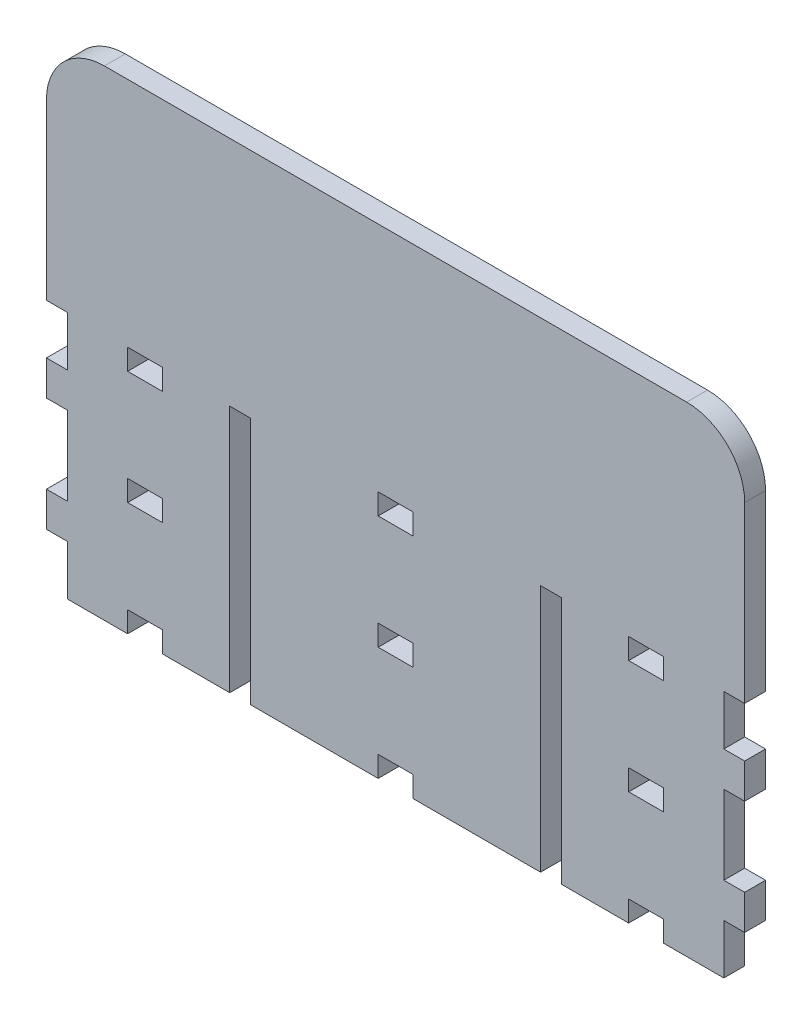
from build123d import *

# Parameters (mm, degrees)
BOSS_EXTRU_1_DEPTH      = 18
ESQUISSE2_W             = 30
ESQUISSE2_H             = 18
ENL_V_MAT_EXTRU_1_DEPTH = 1002.986027847
ESQUISSE3_W             = 18
ESQUISSE3_H             = 43
ESQUISSE3_H_2           = 68
ENL_V_MAT_EXTRU_2_DEPTH = 1002.986027847
ESQUISSE4_W             = 18
ESQUISSE4_H             = 214
ENL_V_MAT_EXTRU_3_DEPTH = 18
ENL_V_MAT_EXTRU_4_DEPTH = 10


with BuildPart() as part:
    # Esquisse1 → Boss.-Extru.1 (new body)
    with BuildSketch(Plane.XY):
        with BuildLine():
            Line((-584, 400), (18, 400))
            Line((18, 400), (18, 764))
            ThreePointArc((18, 764), (3.355339059, 799.355339059), (-32, 814))
            Line((-32, 814), (-534, 814))
            ThreePointArc((-534, 814), (-569.355339059, 799.355339059), (-584, 764))
            Line((-584, 764), (-584, 400))
        make_face()
    extrude(amount=-BOSS_EXTRU_1_DEPTH)

    # Esquisse2 → Enlèv. mat.-Extru.1 (cut, through all)
    with BuildSketch(Plane.XY):
        with Locations((-499, 605)):
            Rectangle(ESQUISSE2_W, ESQUISSE2_H)
        with Locations((-283, 605)):
            Rectangle(ESQUISSE2_W, ESQUISSE2_H)
        with Locations((-67, 605)):
            Rectangle(ESQUISSE2_W, ESQUISSE2_H)
        with Locations((-67, 507)):
            Rectangle(ESQUISSE2_W, ESQUISSE2_H)
        with Locations((-283, 507)):
            Rectangle(ESQUISSE2_W, ESQUISSE2_H)
        with Locations((-499, 507)):
            Rectangle(ESQUISSE2_W, ESQUISSE2_H)
        with Locations((-499, 409)):
            Rectangle(ESQUISSE2_W, ESQUISSE2_H)
        with Locations((-283, 409)):
            Rectangle(ESQUISSE2_W, ESQUISSE2_H)
        with Locations((-67, 409)):
            Rectangle(ESQUISSE2_W, ESQUISSE2_H)
    extrude(amount=-ENL_V_MAT_EXTRU_1_DEPTH, mode=Mode.SUBTRACT)

    # Esquisse3 → Enlèv. mat.-Extru.2 (cut, through all)
    with BuildSketch(Plane.XY):
        with Locations((9, 421.5)):
            Rectangle(ESQUISSE3_W, ESQUISSE3_H)
        with Locations((9, 507)):
            Rectangle(ESQUISSE3_W, ESQUISSE3_H_2)
        with Locations((9, 592.5)):
            Rectangle(ESQUISSE3_W, ESQUISSE3_H)
        with Locations((-575, 421.5)):
            Rectangle(ESQUISSE3_W, ESQUISSE3_H)
        with Locations((-575, 507)):
            Rectangle(ESQUISSE3_W, ESQUISSE3_H_2)
        with Locations((-575, 592.5)):
            Rectangle(ESQUISSE3_W, ESQUISSE3_H)
    extrude(amount=-ENL_V_MAT_EXTRU_2_DEPTH, mode=Mode.SUBTRACT)

    # Esquisse4 → Enlèv. mat.-Extru.3 (cut)
    with BuildSketch(Plane.XY):
        with Locations((-417, 507)):
            Rectangle(ESQUISSE4_W, ESQUISSE4_H)
        with Locations((-149, 507)):
            Rectangle(ESQUISSE4_W, ESQUISSE4_H)
    extrude(amount=-ENL_V_MAT_EXTRU_3_DEPTH, mode=Mode.SUBTRACT)

    # Esquisse6 → Enlèv. mat.-Extru.4 (cut)
    # profile 1 of 2: a face of its own
    with BuildSketch(Plane.XY.offset(-18)):
        with BuildLine():
            add(Edge.make_bspline(
                [(-167.994129765, 780.551148801), (-159.69231092, 785.059400753), (-149.968184403, 788.19753823), (-138.643294269, 789.083100025)],
                knots=[8, 8, 8, 8, 9, 9, 9, 9], degree=3))
            add(Edge.make_bspline(
                [(-188.812497273, 763.827966296), (-183.155305977, 770.374336737), (-176.556570084, 775.900958915), (-167.994129765, 780.551148801)],
                knots=[7, 7, 7, 7, 8, 8, 8, 8], degree=3))
            add(Edge.make_bspline(
                [(-207.242035572, 707.856705731), (-209.360769295, 732.945441347), (-200.095357242, 750.771915681), (-188.812497273, 763.827966296)],
                knots=[6, 6, 6, 6, 7, 7, 7, 7], degree=3))
            add(Edge.make_bspline(
                [(-182.328310806, 658.02856718), (-195.876148801, 669.799424924), (-205.394258608, 685.973459208), (-207.242035572, 707.856705731)],
                knots=[5, 5, 5, 5, 6, 6, 6, 6], degree=3))
            add(Edge.make_bspline(
                [(-126.35705024, 639.599028881), (-150.308215328, 637.632568378), (-169.381469717, 646.779985911), (-182.328310806, 658.02856718)],
                knots=[4, 4, 4, 4, 5, 5, 5, 5], degree=3))
            add(Edge.make_bspline(
                [(-76.52856718, 664.512925902), (-88.391753483, 650.987136517), (-103.937402351, 641.43939889), (-126.35705024, 639.599028881)],
                knots=[3, 3, 3, 3, 4, 4, 4, 4], degree=3))
            add(Edge.make_bspline(
                [(-57.757964428, 720.143294269), (-55.824232333, 695.416121424), (-64.848315447, 677.831665048), (-76.52856718, 664.512925902)],
                knots=[2, 2, 2, 2, 3, 3, 3, 3], degree=3))
            add(Edge.make_bspline(
                [(-82.331141506, 770.312497273), (-69.542602555, 759.036010731), (-59.51186254, 742.565353725), (-57.757964428, 720.143294269)],
                knots=[1, 1, 1, 1, 2, 2, 2, 2], degree=3))
            add(Edge.make_bspline(
                [(-138.643294269, 789.083100025), (-114.190006515, 790.995472528), (-95.136561424, 781.603797726), (-82.331141506, 770.312497273)],
                knots=[0, 0, 0, 0, 1, 1, 1, 1], degree=3))
        make_face()
        with BuildLine():
            add(Edge.make_bspline(
                [(-96.323741328, 691.133523226), (-89.767035601, 695.117431645), (-83.328152139, 708.875075956), (-84.719970715, 720.143294269)],
                knots=[21, 21, 21, 21, 22, 22, 22, 22], degree=3))
            add(Edge.make_bspline(
                [(-111.33987902, 657.687502727), (-102.948659947, 666.226516396), (-98.617830412, 677.655620669), (-96.323741328, 691.133523226)],
                knots=[20, 20, 20, 20, 21, 21, 21, 21], degree=3))
            add(Edge.make_bspline(
                [(-120.555164934, 650.861735042), (-117.389466692, 651.549376101), (-113.938514545, 655.043736451), (-111.33987902, 657.687502727)],
                knots=[19, 19, 19, 19, 20, 20, 20, 20], degree=3))
            add(Edge.make_bspline(
                [(-140.691059026, 650.861735042), (-137.867458766, 650.386311865), (-134.320388454, 650.861735042), (-130.793816461, 650.861735042), (-127.586949328, 650.861735042), (-123.623711482, 650.195109065), (-120.555164934, 650.861735042)],
                knots=[17, 17, 17, 17, 18, 18, 18, 19, 19, 19, 19], degree=3))
            add(Edge.make_bspline(
                [(-153.318712017, 658.369976142), (-150.305114742, 655.38790149), (-145.157625322, 651.613454877), (-140.691059026, 650.861735042)],
                knots=[16, 16, 16, 16, 17, 17, 17, 17], degree=3))
            add(Edge.make_bspline(
                [(-168.335538728, 691.474932189), (-166.067804625, 679.494612639), (-161.208497443, 666.175873493), (-153.318712017, 658.369976142)],
                knots=[15, 15, 15, 15, 16, 16, 16, 16], degree=3))
            add(Edge.make_bspline(
                [(-180.280546049, 714.341064453), (-179.533132584, 704.638297528), (-174.894656022, 693.974348963), (-168.335538728, 691.474932189)],
                knots=[14, 14, 14, 14, 15, 15, 15, 15], degree=3))
            add(Edge.make_bspline(
                [(-176.526425499, 725.944835066), (-181.121321602, 725.538486054), (-180.605935318, 718.564407008), (-180.280546049, 714.341064453)],
                knots=[13, 13, 13, 13, 14, 14, 14, 14], degree=3))
            add(Edge.make_bspline(
                [(-177.208898915, 719.119411891), (-177.024930816, 721.820022242), (-174.639374447, 724.112733287), (-176.526425499, 725.944835066)],
                knots=[12, 12, 12, 12, 13, 13, 13, 13], degree=3))
            add(Edge.make_bspline(
                [(-169.359421106, 695.570117192), (-173.859921593, 698.133268233), (-177.653316232, 712.591644966), (-177.208898915, 719.119411891)],
                knots=[11, 11, 11, 11, 12, 12, 12, 12], degree=3))
            add(Edge.make_bspline(
                [(-165.263719339, 694.887643776), (-166.635039597, 694.77016602), (-168.255268003, 694.941387266), (-169.359421106, 695.570117192)],
                knots=[10, 10, 10, 10, 11, 11, 11, 11], degree=3))
            add(Edge.make_bspline(
                [(-150.588301591, 660.417740899), (-159.102338318, 668.466861991), (-163.545822475, 681.890676549), (-165.263719339, 694.887643776)],
                knots=[9, 9, 9, 9, 10, 10, 10, 10], degree=3))
            add(Edge.make_bspline(
                [(-140.349650063, 654.27444663), (-143.90050998, 654.870448148), (-147.821200897, 657.801535387), (-150.588301591, 660.417740899)],
                knots=[8, 8, 8, 8, 9, 9, 9, 9], degree=3))
            add(Edge.make_bspline(
                [(-121.237982859, 654.27444663), (-124.079153105, 653.635725927), (-127.959019641, 654.27444663), (-130.793816461, 654.27444663), (-134.253553602, 654.27444663), (-137.601497395, 653.813148344), (-140.349650063, 654.27444663)],
                knots=[6, 6, 6, 6, 7, 7, 7, 8, 8, 8, 8], degree=3))
            add(Edge.make_bspline(
                [(-112.363761398, 661.100214314), (-114.830449766, 658.456448039), (-118.402669274, 654.911789294), (-121.237982859, 654.27444663)],
                knots=[5, 5, 5, 5, 6, 6, 6, 6], degree=3))
            add(Edge.make_bspline(
                [(-99.395732973, 694.546234814), (-101.128616002, 681.120008689), (-104.816590719, 669.191710081), (-112.363761398, 661.100214314)],
                knots=[4, 4, 4, 4, 5, 5, 5, 5], degree=3))
            add(Edge.make_bspline(
                [(-96.323741328, 694.887643776), (-97.432717565, 694.104573573), (-98.43592937, 695.337228737), (-99.395732973, 694.546234814)],
                knots=[3, 3, 3, 3, 4, 4, 4, 4], degree=3))
            add(Edge.make_bspline(
                [(-88.132682303, 720.484358722), (-86.157953571, 711.086138239), (-92.116246212, 700.144514977), (-96.323741328, 694.887643776)],
                knots=[2, 2, 2, 2, 3, 3, 3, 3], degree=3))
            add(Edge.make_bspline(
                [(-90.521511512, 726.286244029), (-90.293101682, 724.298079425), (-88.626019976, 722.830985512), (-88.132682303, 720.484358722)],
                knots=[1, 1, 1, 1, 2, 2, 2, 2], degree=3))
            add(Edge.make_bspline(
                [(-84.719970715, 720.143294269), (-85.131659626, 723.475390623), (-88.352134885, 730.701650658), (-90.521511512, 726.286244029)],
                knots=[0, 0, 0, 0, 1, 1, 1, 1], degree=3))
        make_face(mode=Mode.SUBTRACT)
        with BuildLine():
            add(Edge.make_bspline(
                [(-165.263719339, 731.746892628), (-167.581407326, 731.2948961), (-169.289313413, 730.878556311), (-170.041894522, 729.016482201)],
                knots=[14, 14, 14, 14, 15, 15, 15, 15], degree=3))
            add(Edge.make_bspline(
                [(-164.922310376, 732.088301591), (-165.194300665, 732.068147782), (-165.222722702, 731.754644093), (-165.263719339, 731.746892628)],
                knots=[13, 13, 13, 13, 14, 14, 14, 14], degree=3))
            add(Edge.make_bspline(
                [(-95.640923403, 729.357546654), (-97.547783754, 732.657775874), (-105.330254456, 732.088301591), (-110.657750114, 732.088301591), (-116.752124027, 732.088301591), (-123.382899308, 732.088301591), (-128.74587945, 732.088301591), (-142.766556801, 732.088301591), (-152.996595589, 732.963700353), (-164.922310376, 732.088301591)],
                knots=[10, 10, 10, 10, 11, 11, 11, 12, 12, 12, 13, 13, 13, 13], degree=3))
            add(Edge.make_bspline(
                [(-97.347623707, 713.317182075), (-96.401600486, 716.391585286), (-93.615551768, 725.852678762), (-95.640923403, 729.357546654)],
                knots=[9, 9, 9, 9, 10, 10, 10, 10], degree=3))
            add(Edge.make_bspline(
                [(-105.19727377, 702.396229387), (-100.721061206, 703.809407555), (-98.74185385, 708.786537002), (-97.347623707, 713.317182075)],
                knots=[8, 8, 8, 8, 9, 9, 9, 9], degree=3))
            add(Edge.make_bspline(
                [(-121.237982859, 702.396229387), (-117.704348419, 701.239021813), (-108.404657667, 701.383371314), (-105.19727377, 702.396229387)],
                knots=[7, 7, 7, 7, 8, 8, 8, 8], degree=3))
            add(Edge.make_bspline(
                [(-126.698114693, 707.515296768), (-125.474761286, 705.702832033), (-123.047691517, 702.98878581), (-121.237982859, 702.396229387)],
                knots=[6, 6, 6, 6, 7, 7, 7, 7], degree=3))
            add(Edge.make_bspline(
                [(-131.817698839, 712.975773112), (-128.721074762, 712.897569445), (-128.143676759, 709.656423612), (-126.698114693, 707.515296768)],
                knots=[5, 5, 5, 5, 6, 6, 6, 6], degree=3))
            add(Edge.make_bspline(
                [(-136.936938475, 707.515296768), (-135.760438367, 709.240945097), (-135.422646755, 713.067757162), (-131.817698839, 712.975773112)],
                knots=[4, 4, 4, 4, 5, 5, 5, 5], degree=3))
            add(Edge.make_bspline(
                [(-142.39741482, 702.396229387), (-140.443012151, 703.089038089), (-138.123946125, 705.774834529), (-136.936938475, 707.515296768)],
                knots=[3, 3, 3, 3, 4, 4, 4, 4], degree=3))
            add(Edge.make_bspline(
                [(-159.803242994, 702.73729384), (-156.470629877, 701.472943797), (-145.597908525, 701.261759443), (-142.39741482, 702.396229387)],
                knots=[2, 2, 2, 2, 3, 3, 3, 3], degree=3))
            add(Edge.make_bspline(
                [(-167.652548548, 713.658935547), (-166.203713642, 709.484168838), (-164.250344502, 704.424701608), (-159.803242994, 702.73729384)],
                knots=[1, 1, 1, 1, 2, 2, 2, 2], degree=3))
            add(Edge.make_bspline(
                [(-170.041894522, 729.016482201), (-171.618025706, 725.117495386), (-168.325720206, 715.597490777), (-167.652548548, 713.658935547)],
                knots=[0, 0, 0, 0, 1, 1, 1, 1], degree=3))
        make_face(mode=Mode.SUBTRACT)
        with BuildLine():
            add(Edge.make_bspline(
                [(-99.395732973, 739.937779399), (-99.5121772, 743.107267245), (-103.825436748, 743.925821933), (-106.562220601, 744.715782327)],
                knots=[14, 14, 14, 14, 15, 15, 15, 15], degree=3))
            add(Edge.make_bspline(
                [(-106.903285054, 741.30272623), (-104.488273119, 740.578739414), (-101.782839634, 738.405573182), (-99.395732973, 739.937779399)],
                knots=[13, 13, 13, 13, 14, 14, 14, 14], degree=3))
            add(Edge.make_bspline(
                [(-124.308940974, 743.009426534), (-117.181727434, 743.290890835), (-111.771204975, 742.761724168), (-106.903285054, 741.30272623)],
                knots=[12, 12, 12, 12, 13, 13, 13, 13], degree=3))
            add(Edge.make_bspline(
                [(-123.626812068, 739.937779399), (-122.200542537, 741.25725097), (-124.643115236, 742.838549797), (-124.308940974, 743.009426534)],
                knots=[11, 11, 11, 11, 12, 12, 12, 12], degree=3))
            add(Edge.make_bspline(
                [(-128.74587945, 741.30272623), (-127.13529731, 740.933239739), (-125.475450306, 738.584029128), (-123.626812068, 739.937779399)],
                knots=[10, 10, 10, 10, 11, 11, 11, 11], degree=3))
            add(Edge.make_bspline(
                [(-142.39741482, 740.620252815), (-137.8722819, 740.311916769), (-133.076364475, 742.295947259), (-128.74587945, 741.30272623)],
                knots=[9, 9, 9, 9, 10, 10, 10, 10], degree=3))
            add(Edge.make_bspline(
                [(-159.803242994, 748.470075132), (-154.395648866, 745.531236429), (-150.242069494, 741.154931634), (-142.39741482, 740.620252815)],
                knots=[8, 8, 8, 8, 9, 9, 9, 9], degree=3))
            add(Edge.make_bspline(
                [(-162.874890129, 738.231423605), (-161.378168396, 741.027979865), (-159.935190152, 744.61845838), (-159.803242994, 748.470075132)],
                knots=[7, 7, 7, 7, 8, 8, 8, 8], degree=3))
            add(Edge.make_bspline(
                [(-166.629182934, 735.501013178), (-164.136139586, 734.100237354), (-163.743570956, 736.607750103), (-162.874890129, 738.231423605)],
                knots=[6, 6, 6, 6, 7, 7, 7, 7], degree=3))
            add(Edge.make_bspline(
                [(-163.215954582, 749.835021964), (-162.18759358, 744.43121744), (-166.808155645, 739.636161289), (-166.629182934, 735.501013178)],
                knots=[5, 5, 5, 5, 6, 6, 6, 6], degree=3))
            add(Edge.make_bspline(
                [(-165.605128301, 754.613197147), (-165.278016485, 752.26415879), (-163.600944003, 751.857465268), (-163.215954582, 749.835021964)],
                knots=[4, 4, 4, 4, 5, 5, 5, 5], degree=3))
            add(Edge.make_bspline(
                [(-159.461661777, 752.565260136), (-161.86289333, 754.463507748), (-164.079812275, 757.267643218), (-165.605128301, 754.613197147)],
                knots=[3, 3, 3, 3, 4, 4, 4, 4], degree=3))
            add(Edge.make_bspline(
                [(-133.524054633, 744.715782327), (-145.625986054, 742.483360453), (-152.676201709, 747.200901956), (-159.461661777, 752.565260136)],
                knots=[2, 2, 2, 2, 3, 3, 3, 3], degree=3))
            add(Edge.make_bspline(
                [(-130.793816461, 745.73983696), (-131.731915962, 745.530375155), (-132.501378038, 744.90422905), (-133.524054633, 744.715782327)],
                knots=[1, 1, 1, 1, 2, 2, 2, 2], degree=3))
            add(Edge.make_bspline(
                [(-106.562220601, 744.715782327), (-113.384198681, 746.684137633), (-122.915055341, 747.498041441), (-130.793816461, 745.73983696)],
                knots=[0, 0, 0, 0, 1, 1, 1, 1], degree=3))
        make_face(mode=Mode.SUBTRACT)
        with BuildLine():
            add(Edge.make_bspline(
                [(-174.137079525, 731.405483665), (-172.050901954, 731.697283253), (-172.84344617, 734.208068843), (-172.772132694, 735.159604216)],
                knots=[16, 16, 16, 16, 17, 17, 17, 17], degree=3))
            add(Edge.make_bspline(
                [(-176.185016536, 739.596370436), (-176.082008181, 736.845117182), (-176.745016808, 732.037141923), (-174.137079525, 731.405483665)],
                knots=[15, 15, 15, 15, 16, 16, 16, 16], degree=3))
            add(Edge.make_bspline(
                [(-175.843952083, 751.541377758), (-176.589815256, 748.484544533), (-176.351759158, 744.050534389), (-176.185016536, 739.596370436)],
                knots=[14, 14, 14, 14, 15, 15, 15, 15], degree=3))
            add(Edge.make_bspline(
                [(-137.619411891, 777.820738374), (-154.780293777, 776.558455388), (-172.045217547, 767.101151517), (-175.843952083, 751.541377758)],
                knots=[13, 13, 13, 13, 14, 14, 14, 14], degree=3))
            add(Edge.make_bspline(
                [(-114.411526155, 773.725208861), (-122.282880319, 776.29766166), (-128.826494684, 778.467555051), (-137.619411891, 777.820738374)],
                knots=[12, 12, 12, 12, 13, 13, 13, 13], degree=3))
            add(Edge.make_bspline(
                [(-99.736797426, 767.582086846), (-103.061314569, 770.178483059), (-108.789130323, 771.887422674), (-114.411526155, 773.725208861)],
                knots=[11, 11, 11, 11, 12, 12, 12, 12], degree=3))
            add(Edge.make_bspline(
                [(-90.863264984, 753.589142514), (-91.66046008, 758.665490711), (-96.793307843, 765.283519139), (-99.736797426, 767.582086846)],
                knots=[10, 10, 10, 10, 11, 11, 11, 11], degree=3))
            add(Edge.make_bspline(
                [(-91.887147363, 737.548950189), (-91.044477007, 741.320640727), (-90.46191136, 751.031331371), (-90.863264984, 753.589142514)],
                knots=[9, 9, 9, 9, 10, 10, 10, 10], degree=3))
            add(Edge.make_bspline(
                [(-94.617041025, 742.326608608), (-94.843383798, 740.066453715), (-96.311338985, 734.514854596), (-93.9342231, 734.135721837), (-92.148974619, 733.850984696), (-92.464200856, 734.964439556), (-91.887147363, 737.548950189)],
                knots=[7, 7, 7, 7, 8, 8, 8, 9, 9, 9, 9], degree=3))
            add(Edge.make_bspline(
                [(-93.9342231, 751.541377758), (-93.706502288, 748.963757315), (-94.273220496, 745.765158412), (-94.617041025, 742.326608608)],
                knots=[6, 6, 6, 6, 7, 7, 7, 7], degree=3))
            add(Edge.make_bspline(
                [(-102.466691088, 765.53432209), (-99.032964418, 763.120860448), (-94.382085513, 756.598605675), (-93.9342231, 751.541377758)],
                knots=[5, 5, 5, 5, 6, 6, 6, 6], degree=3))
            add(Edge.make_bspline(
                [(-115.777506515, 770.653389472), (-110.879614263, 769.070195841), (-105.576234273, 767.719890666), (-102.466691088, 765.53432209)],
                knots=[4, 4, 4, 4, 5, 5, 5, 5], degree=3))
            add(Edge.make_bspline(
                [(-137.960820854, 774.407682277), (-128.536417644, 775.083093246), (-122.86200087, 772.944205714), (-115.777506515, 770.653389472)],
                knots=[3, 3, 3, 3, 4, 4, 4, 4], degree=3))
            add(Edge.make_bspline(
                [(-164.23983696, 764.510439712), (-157.788551155, 769.886338962), (-147.056906463, 773.75621472), (-137.960820854, 774.407682277)],
                knots=[2, 2, 2, 2, 3, 3, 3, 3], degree=3))
            add(Edge.make_bspline(
                [(-172.772132694, 750.858904342), (-172.060892731, 755.388171376), (-168.271632207, 761.15061034), (-164.23983696, 764.510439712)],
                knots=[1, 1, 1, 1, 2, 2, 2, 2], degree=3))
            add(Edge.make_bspline(
                [(-172.772132694, 735.159604216), (-172.368022994, 740.550145121), (-173.551585547, 745.893488219), (-172.772132694, 750.858904342)],
                knots=[0, 0, 0, 0, 1, 1, 1, 1], degree=3))
        make_face(mode=Mode.SUBTRACT)
    # profile 2 of 2: a face of its own
    with BuildSketch(Plane.XY.offset(-18)):
        with BuildLine():
            add(Edge.make_bspline(
                [(-426.961036514, 639.581803404), (-404.9193156, 641.391512062), (-388.80315892, 651.176961279), (-377.141855212, 664.49156631)],
                knots=[7, 7, 7, 7, 8, 8, 8, 8], degree=3))
            add(Edge.make_bspline(
                [(-377.141855212, 664.49156631), (-365.58252633, 677.688693585), (-356.81510283, 696.606057405), (-358.770539027, 720.538791231)],
                knots=[8, 8, 8, 8, 9, 9, 9, 9], degree=3))
            add(Edge.make_bspline(
                [(-358.770539027, 720.538791231), (-360.61504315, 743.112262634), (-370.627868668, 758.941959624), (-383.680301933, 770.358489298)],
                knots=[0, 0, 0, 0, 1, 1, 1, 1], degree=3))
            add(Edge.make_bspline(
                [(-383.680301933, 770.358489298), (-396.699317772, 781.74573566), (-415.020335562, 790.997022821), (-440.038618976, 789.040553095)],
                knots=[1, 1, 1, 1, 2, 2, 2, 2], degree=3))
            add(Edge.make_bspline(
                [(-440.038618976, 789.040553095), (-451.182124833, 788.169288447), (-461.166183804, 784.854934336), (-469.307977964, 780.32239446)],
                knots=[2, 2, 2, 2, 3, 3, 3, 3], degree=3))
            add(Edge.make_bspline(
                [(-469.307977964, 780.32239446), (-477.690928808, 775.655323607), (-484.533060697, 770.254964179), (-490.16992593, 763.819698067)],
                knots=[3, 3, 3, 3, 4, 4, 4, 4], degree=3))
            add(Edge.make_bspline(
                [(-490.16992593, 763.819698067), (-501.449857568, 750.94038085), (-510.356462926, 732.074004444), (-508.229460973, 707.461208769)],
                knots=[4, 4, 4, 4, 5, 5, 5, 5], degree=3))
            add(Edge.make_bspline(
                [(-508.229460973, 707.461208769), (-506.324667679, 685.418798835), (-496.465665674, 669.771519651), (-483.008261435, 657.953119589)],
                knots=[5, 5, 5, 5, 6, 6, 6, 6], degree=3))
            add(Edge.make_bspline(
                [(-483.008261435, 657.953119589), (-470.055908194, 646.577758806), (-451.272386335, 637.586059589), (-426.961036514, 639.581803404)],
                knots=[6, 6, 6, 6, 7, 7, 7, 7], degree=3))
        make_face()
        with BuildLine():
            add(Edge.make_bspline(
                [(-400.494434958, 692.332675832), (-400.457572437, 691.435917477), (-400.664622675, 690.294212833), (-400.183342836, 689.841871796)],
                knots=[17, 17, 17, 17, 18, 18, 18, 18], degree=3))
            add(Edge.make_bspline(
                [(-400.183342836, 689.841871796), (-400.117197003, 688.529979435), (-401.57688396, 688.744264375), (-402.051618118, 687.973596515)],
                knots=[18, 18, 18, 18, 19, 19, 19, 19], degree=3))
            add(Edge.make_bspline(
                [(-402.051618118, 687.973596515), (-404.009121372, 676.167254287), (-407.839034023, 666.231943417), (-415.12920058, 658.704409781)],
                knots=[0, 0, 0, 0, 1, 1, 1, 1], degree=3))
            add(Edge.make_bspline(
                [(-415.12920058, 658.704409781), (-417.398829485, 656.360711323), (-420.427412926, 653.382081766), (-423.224485951, 652.788147305)],
                knots=[1, 1, 1, 1, 2, 2, 2, 2], degree=3))
            add(Edge.make_bspline(
                [(-423.224485951, 652.788147305), (-425.801072864, 652.241410651), (-429.078736709, 652.788147305), (-431.631896973, 652.788147305), (-434.655312771, 652.788147305), (-437.714213052, 652.470164991), (-440.038618976, 652.788147305)],
                knots=[2, 2, 2, 2, 3, 3, 3, 4, 4, 4, 4], degree=3))
            add(Edge.make_bspline(
                [(-440.038618976, 652.788147305), (-447.38425157, 653.793081658), (-453.163571501, 660.242300406), (-456.852924256, 666.177510908)],
                knots=[4, 4, 4, 4, 5, 5, 5, 5], degree=3))
            add(Edge.make_bspline(
                [(-456.852924256, 666.177510908), (-460.984799527, 672.823444609), (-463.204991312, 680.577321017), (-464.63728976, 688.284688637)],
                knots=[5, 5, 5, 5, 6, 6, 6, 6], degree=3))
            add(Edge.make_bspline(
                [(-464.63728976, 688.284688637), (-465.586758076, 688.892058971), (-466.775832782, 689.259995169), (-467.75096706, 689.841871796)],
                knots=[6, 6, 6, 6, 7, 7, 7, 7], degree=3))
            add(Edge.make_bspline(
                [(-467.75096706, 689.841871796), (-467.554079853, 690.889869843), (-466.856964781, 691.438673554), (-467.128266051, 692.955549096)],
                knots=[7, 7, 7, 7, 8, 8, 8, 8], degree=3))
            add(Edge.make_bspline(
                [(-467.128266051, 692.955549096), (-465.998274731, 691.802131127), (-464.416631394, 691.100365177), (-462.457750101, 690.775492673)],
                knots=[8, 8, 8, 8, 9, 9, 9, 9], degree=3))
            add(Edge.make_bspline(
                [(-462.457750101, 690.775492673), (-460.473030592, 679.900015245), (-456.820540359, 667.833568308), (-449.379995384, 660.883777185)],
                knots=[9, 9, 9, 9, 10, 10, 10, 10], degree=3))
            add(Edge.make_bspline(
                [(-449.379995384, 660.883777185), (-446.969634328, 658.632062776), (-443.471312118, 656.114386996), (-440.350055608, 655.590732482)],
                knots=[10, 10, 10, 10, 11, 11, 11, 11], degree=3))
            add(Edge.make_bspline(
                [(-440.350055608, 655.590732482), (-438.075603569, 655.208671393), (-434.866841634, 655.590732482), (-431.943333605, 655.590732482), (-429.420834691, 655.590732482), (-426.303023277, 655.071901102), (-423.847359215, 655.590732482)],
                knots=[11, 11, 11, 11, 12, 12, 12, 13, 13, 13, 13], degree=3))
            add(Edge.make_bspline(
                [(-423.847359215, 655.590732482), (-421.240455461, 656.14160325), (-418.124711104, 659.134013188), (-416.063165966, 661.506994959)],
                knots=[13, 13, 13, 13, 14, 14, 14, 14], degree=3))
            add(Edge.make_bspline(
                [(-416.063165966, 661.506994959), (-409.674580898, 668.859517743), (-406.024502231, 678.94193419), (-404.230985522, 690.46440055)],
                knots=[14, 14, 14, 14, 15, 15, 15, 15], degree=3))
            add(Edge.make_bspline(
                [(-404.230985522, 690.46440055), (-404.333304858, 691.91444124), (-402.604555943, 690.011370494), (-402.051618118, 691.087273814)],
                knots=[15, 15, 15, 15, 16, 16, 16, 16], degree=3))
            add(Edge.make_bspline(
                [(-402.051618118, 691.087273814), (-401.72950169, 691.516188202), (-400.816551386, 692.933155975), (-400.494434958, 692.332675832)],
                knots=[16, 16, 16, 16, 17, 17, 17, 17], degree=3))
        make_face(mode=Mode.SUBTRACT)
        with BuildLine():
            add(Edge.make_bspline(
                [(-490.792626939, 715.99703672), (-490.697197794, 716.010300338), (-490.615032267, 716.010300338), (-490.542340752, 716.000826325)],
                knots=[0, 0, 0, 0, 1, 1, 1, 1], degree=3))
            Line((-490.542340752, 716.000826325), (-490.542340752, 701.59791563))
            add(Edge.make_bspline(
                [(-490.542340752, 701.59791563), (-494.009829358, 704.094404073), (-493.498232678, 713.1892839), (-490.792626939, 715.99703672)],
                knots=[2, 2, 2, 2, 3, 3, 3, 3], degree=3))
        make_face(mode=Mode.SUBTRACT)
        with BuildLine():
            add(Edge.make_bspline(
                [(-479.253451866, 693.088529782), (-483.598406292, 694.082956593), (-486.696580662, 696.323818952), (-488.778451863, 699.581156733)],
                knots=[5, 5, 5, 5, 6, 6, 6, 6], degree=3))
            Line((-488.778451863, 699.581156733), (-488.778451863, 717.811568512))
            add(Edge.make_bspline(
                [(-488.778451863, 717.811568512), (-486.892606595, 721.187762088), (-483.570845528, 723.128901139), (-479.583147504, 724.403758723)],
                knots=[1, 1, 1, 1, 2, 2, 2, 2], degree=3))
            add(Edge.make_bspline(
                [(-479.583147504, 724.403758723), (-479.479277875, 724.403758723), (-479.375752755, 724.403758723), (-479.271883127, 724.403758723)],
                knots=[2, 2, 2, 2, 3, 3, 3, 3], degree=3))
            add(Edge.make_bspline(
                [(-479.271883127, 724.403758723), (-479.26516519, 724.400141373), (-479.259997547, 724.395490494), (-479.253451866, 724.391700889)],
                knots=[3, 3, 3, 3, 4, 4, 4, 4], degree=3))
            Line((-479.253451866, 724.391700889), (-479.253451866, 693.088529782))
        make_face(mode=Mode.SUBTRACT)
        with BuildLine():
            add(Edge.make_bspline(
                [(-469.307977964, 691.398365936), (-471.272199155, 690.847839678), (-475.481933583, 691.064880694), (-477.048590755, 691.086584795)],
                knots=[0, 0, 0, 0, 1, 1, 1, 1], degree=3))
            Line((-477.048590755, 691.086584795), (-477.048590755, 726.175743586))
            add(Edge.make_bspline(
                [(-477.048590755, 726.175743586), (-475.350158681, 727.013590808), (-471.388126618, 726.634113541), (-469.619242341, 726.272034005)],
                knots=[2, 2, 2, 2, 3, 3, 3, 3], degree=3))
            add(Edge.make_bspline(
                [(-469.619242341, 726.272034005), (-468.894738761, 715.268399025), (-469.513994674, 702.920832296), (-469.307977964, 691.398365936)],
                knots=[3, 3, 3, 3, 4, 4, 4, 4], degree=3))
        make_face(mode=Mode.SUBTRACT)
        with BuildLine():
            add(Edge.make_bspline(
                [(-398.626159677, 725.026631987), (-397.15096979, 726.117521472), (-392.785000281, 725.74579567), (-390.706229666, 725.369246733)],
                knots=[1, 1, 1, 1, 2, 2, 2, 2], degree=3))
            Line((-390.706229666, 725.369246733), (-390.706229666, 690.425126462))
            add(Edge.make_bspline(
                [(-390.706229666, 690.425126462), (-392.781555186, 689.955215438), (-396.65487604, 689.967273272), (-398.626159677, 690.46440055)],
                knots=[3, 3, 3, 3, 4, 4, 4, 4], degree=3))
            add(Edge.make_bspline(
                [(-398.626159677, 690.46440055), (-398.626159677, 701.985488872), (-398.626159677, 713.505543665), (-398.626159677, 725.026631987)],
                knots=[0, 0, 0, 0, 1, 1, 1, 1], degree=3))
        make_face(mode=Mode.SUBTRACT)
        with BuildLine():
            add(Edge.make_bspline(
                [(-379.064563002, 698.722294429), (-380.42434219, 694.911674312), (-385.002185071, 693.18878206), (-388.501368555, 692.431205563)],
                knots=[3, 3, 3, 3, 4, 4, 4, 4], degree=3))
            Line((-388.501368555, 692.431205563), (-388.501368555, 723.3530046))
            add(Edge.make_bspline(
                [(-388.501368555, 723.3530046), (-385.248509398, 722.537205989), (-380.536996812, 721.069939822), (-379.064563002, 716.774767026)],
                knots=[1, 1, 1, 1, 2, 2, 2, 2], degree=3))
            Line((-379.064563002, 716.774767026), (-379.064563002, 698.722294429))
        make_face(mode=Mode.SUBTRACT)
        with BuildLine():
            add(Edge.make_bspline(
                [(-376.83007407, 715.062726825), (-374.698938003, 712.144730949), (-373.687113459, 703.184554356), (-377.300674113, 700.979520991)],
                knots=[2, 2, 2, 2, 3, 3, 3, 3], degree=3))
            Line((-377.300674113, 700.979520991), (-377.300674113, 715.062726825))
            add(Edge.make_bspline(
                [(-377.300674113, 715.062726825), (-377.143922269, 715.062726825), (-376.987170424, 715.062726825), (-376.83007407, 715.062726825)],
                knots=[1, 1, 1, 1, 2, 2, 2, 2], degree=3))
        make_face(mode=Mode.SUBTRACT)
        with BuildLine():
            add(Edge.make_bspline(
                [(-411.704431158, 732.188124227), (-415.854737689, 733.324488973), (-420.557293026, 733.420434882), (-426.33850776, 733.434043009)],
                knots=[14, 14, 14, 14, 15, 15, 15, 15], degree=3))
            add(Edge.make_bspline(
                [(-426.33850776, 733.434043009), (-427.116410321, 732.804968574), (-424.391684301, 731.858600844), (-425.715634496, 730.631630087)],
                knots=[15, 15, 15, 15, 16, 16, 16, 16], degree=3))
            add(Edge.make_bspline(
                [(-425.715634496, 730.631630087), (-427.517763945, 729.638925823), (-429.182434083, 731.604008288), (-430.697931587, 731.877032105)],
                knots=[0, 0, 0, 0, 1, 1, 1, 1], degree=3))
            add(Edge.make_bspline(
                [(-430.697931587, 731.877032105), (-434.439649794, 732.551754056), (-438.367747666, 731.026610284), (-441.907238767, 731.253986586)],
                knots=[1, 1, 1, 1, 2, 2, 2, 2], degree=3))
            add(Edge.make_bspline(
                [(-441.907238767, 731.253986586), (-448.760739471, 731.695131063), (-452.495911996, 735.439260836), (-457.164360888, 738.104214449)],
                knots=[2, 2, 2, 2, 3, 3, 3, 3], degree=3))
            add(Edge.make_bspline(
                [(-457.164360888, 738.104214449), (-457.866299093, 736.990931843), (-457.744170458, 735.499205498), (-458.098498529, 734.056399509)],
                knots=[3, 3, 3, 3, 4, 4, 4, 4], degree=3))
            add(Edge.make_bspline(
                [(-458.098498529, 734.056399509), (-458.870888937, 730.911544095), (-460.115946445, 726.905242555), (-462.457750101, 726.583815146)],
                knots=[4, 4, 4, 4, 5, 5, 5, 5], degree=3))
            add(Edge.make_bspline(
                [(-462.457750101, 726.583815146), (-464.343078606, 727.492286826), (-462.732496466, 729.601374282), (-462.146313469, 730.942722209)],
                knots=[5, 5, 5, 5, 6, 6, 6, 6], degree=3))
            add(Edge.make_bspline(
                [(-462.146313469, 730.942722209), (-461.204941128, 733.096423652), (-459.506853563, 735.449423868), (-460.278038188, 739.350133231)],
                knots=[6, 6, 6, 6, 7, 7, 7, 7], degree=3))
            add(Edge.make_bspline(
                [(-460.278038188, 739.350133231), (-460.643218309, 741.19808245), (-462.151653367, 741.359485173), (-462.146313469, 743.709212549)],
                knots=[7, 7, 7, 7, 8, 8, 8, 8], degree=3))
            add(Edge.make_bspline(
                [(-462.146313469, 743.709212549), (-461.894993754, 743.976724213), (-461.293480082, 743.894386431), (-461.212175829, 744.332085813)],
                knots=[8, 8, 8, 8, 9, 9, 9, 9], degree=3))
            add(Edge.make_bspline(
                [(-461.212175829, 744.332085813), (-456.147540956, 741.526916814), (-449.363286671, 733.882077677), (-440.972928872, 733.745307386)],
                knots=[9, 9, 9, 9, 10, 10, 10, 10], degree=3))
            add(Edge.make_bspline(
                [(-440.972928872, 733.745307386), (-436.635553656, 733.674510674), (-432.193792047, 735.61220463), (-427.89534641, 735.92467479)],
                knots=[10, 10, 10, 10, 11, 11, 11, 11], degree=3))
            add(Edge.make_bspline(
                [(-427.89534641, 735.92467479), (-421.648354766, 736.379599649), (-415.518840879, 735.884539428), (-410.458340121, 734.368352905)],
                knots=[11, 11, 11, 11, 12, 12, 12, 12], degree=3))
            add(Edge.make_bspline(
                [(-410.458340121, 734.368352905), (-408.484300408, 733.775968736), (-404.833532722, 733.239395114), (-404.853858785, 730.319676691)],
                knots=[12, 12, 12, 12, 13, 13, 13, 13], degree=3))
            add(Edge.make_bspline(
                [(-404.853858785, 730.319676691), (-407.324336758, 729.451857138), (-409.370378967, 731.549403524), (-411.704431158, 732.188124227)],
                knots=[13, 13, 13, 13, 14, 14, 14, 14], degree=3))
        make_face(mode=Mode.SUBTRACT)
        with BuildLine():
            add(Edge.make_bspline(
                [(-436.614194064, 778.27161624), (-418.639752879, 779.408670005), (-401.664733895, 772.485922882), (-391.15340306, 763.948459506)],
                knots=[11, 11, 11, 11, 12, 12, 12, 12], degree=3))
            add(Edge.make_bspline(
                [(-391.15340306, 763.948459506), (-375.850288914, 751.51838274), (-365.338958079, 732.382083103), (-372.782086875, 706.656004822)],
                knots=[12, 12, 12, 12, 13, 13, 13, 13], degree=3))
            add(Edge.make_bspline(
                [(-372.782086875, 706.656004822), (-373.359484878, 709.585369513), (-372.964676936, 711.65518288), (-373.716396771, 713.817669316)],
                knots=[0, 0, 0, 0, 1, 1, 1, 1], degree=3))
            add(Edge.make_bspline(
                [(-373.716396771, 713.817669316), (-374.749925416, 716.788719663), (-377.809859226, 717.961430166), (-379.010130493, 720.667897179)],
                knots=[1, 1, 1, 1, 2, 2, 2, 2], degree=3))
            add(Edge.make_bspline(
                [(-379.010130493, 720.667897179), (-379.27230226, 735.345381985), (-385.305353473, 746.941917897), (-394.267080359, 754.918691984)],
                knots=[2, 2, 2, 2, 3, 3, 3, 3], degree=3))
            add(Edge.make_bspline(
                [(-394.267080359, 754.918691984), (-404.214793573, 763.772415126), (-418.505049646, 770.279166969), (-437.236378309, 769.241848719)],
                knots=[3, 3, 3, 3, 4, 4, 4, 4], degree=3))
            add(Edge.make_bspline(
                [(-437.236378309, 769.241848719), (-451.242758513, 768.466013215), (-462.60347764, 762.917514682), (-471.487517623, 755.229784106)],
                knots=[4, 4, 4, 4, 5, 5, 5, 5], degree=3))
            add(Edge.make_bspline(
                [(-471.487517623, 755.229784106), (-480.281296104, 747.620084944), (-487.077435968, 736.760799465), (-487.367513007, 723.158356705)],
                knots=[5, 5, 5, 5, 6, 6, 6, 6], degree=3))
            add(Edge.make_bspline(
                [(-487.367513007, 723.158356705), (-488.514040785, 722.069706532), (-489.34947644, 720.708549306), (-490.481018052, 719.421806142)],
                knots=[6, 6, 6, 6, 7, 7, 7, 7], degree=3))
            add(Edge.make_bspline(
                [(-490.481018052, 719.421806142), (-492.685706908, 716.915499177), (-495.198215045, 715.199152606), (-494.840441879, 709.769682121)],
                knots=[7, 7, 7, 7, 8, 8, 8, 8], degree=3))
            add(Edge.make_bspline(
                [(-494.840441879, 709.769682121), (-500.538974321, 730.5527374), (-491.926235608, 747.835575666), (-482.07395154, 758.654898038)],
                knots=[8, 8, 8, 8, 9, 9, 9, 9], degree=3))
            add(Edge.make_bspline(
                [(-482.07395154, 758.654898038), (-476.982444922, 764.24663252), (-470.085880525, 768.708031173), (-462.769014478, 772.043917132)],
                knots=[9, 9, 9, 9, 10, 10, 10, 10], degree=3))
            add(Edge.make_bspline(
                [(-462.769014478, 772.043917132), (-454.978103293, 775.596327341), (-446.700400116, 777.633584556), (-436.614194064, 778.27161624)],
                knots=[10, 10, 10, 10, 11, 11, 11, 11], degree=3))
        make_face(mode=Mode.SUBTRACT)
        with BuildLine():
            add(Edge.make_bspline(
                [(-436.924941677, 760.834782206), (-451.779332135, 759.967996182), (-467.397155753, 751.673239782), (-468.996541332, 738.727259968)],
                knots=[13, 13, 13, 13, 14, 14, 14, 14], degree=3))
            add(Edge.make_bspline(
                [(-468.996541332, 738.727259968), (-469.382908791, 735.598596503), (-468.312862133, 732.570702081), (-468.996541332, 728.76318255)],
                knots=[14, 14, 14, 14, 15, 15, 15, 15], degree=3))
            add(Edge.make_bspline(
                [(-468.996541332, 728.76318255), (-469.793908682, 728.425563193), (-470.480860722, 729.709205771), (-470.864816614, 728.76318255)],
                knots=[0, 0, 0, 0, 1, 1, 1, 1], degree=3))
            add(Edge.make_bspline(
                [(-470.864816614, 728.76318255), (-472.009794098, 729.577603123), (-471.487517623, 731.847748793), (-471.487517623, 733.745307386), (-471.487517623, 735.719863864), (-471.673036015, 737.677367118), (-471.487517623, 739.350133231)],
                knots=[1, 1, 1, 1, 2, 2, 2, 3, 3, 3, 3], degree=3))
            add(Edge.make_bspline(
                [(-471.487517623, 739.350133231), (-469.868667254, 753.930466344), (-451.177473954, 763.345395541), (-435.679884168, 763.636850619), (-430.339986166, 763.737275152), (-424.284886341, 761.913613857), (-419.799716529, 760.523345574)],
                knots=[3, 3, 3, 3, 4, 4, 4, 5, 5, 5, 5], degree=3))
            add(Edge.make_bspline(
                [(-419.799716529, 760.523345574), (-414.950744634, 759.020250414), (-409.750717508, 757.701123353), (-406.410352926, 755.541392993)],
                knots=[5, 5, 5, 5, 6, 6, 6, 6], degree=3))
            add(Edge.make_bspline(
                [(-406.410352926, 755.541392993), (-402.196656638, 752.816150209), (-397.461028384, 746.594307763), (-397.069665536, 740.595535249)],
                knots=[6, 6, 6, 6, 7, 7, 7, 7], degree=3))
            add(Edge.make_bspline(
                [(-397.069665536, 740.595535249), (-396.818862585, 736.753392509), (-398.090791838, 732.719185696), (-398.003630923, 728.140309287)],
                knots=[7, 7, 7, 7, 8, 8, 8, 8], degree=3))
            add(Edge.make_bspline(
                [(-398.003630923, 728.140309287), (-399.236975106, 728.014218792), (-400.381435826, 726.172470745), (-400.8062161, 726.272034005)],
                knots=[8, 8, 8, 8, 9, 9, 9, 9], degree=3))
            add(Edge.make_bspline(
                [(-400.8062161, 726.272034005), (-401.141079381, 731.366296699), (-399.102616382, 736.33670821), (-399.871906204, 741.52967289)],
                knots=[9, 9, 9, 9, 10, 10, 10, 10], degree=3))
            add(Edge.make_bspline(
                [(-399.871906204, 741.52967289), (-400.507181812, 745.81812775), (-404.332615838, 751.01074792), (-407.967536085, 753.361508825)],
                knots=[10, 10, 10, 10, 11, 11, 11, 11], degree=3))
            add(Edge.make_bspline(
                [(-407.967536085, 753.361508825), (-410.868306484, 755.237707826), (-415.341762971, 756.279676955), (-419.799716529, 757.720760397)],
                knots=[11, 11, 11, 11, 12, 12, 12, 12], degree=3))
            add(Edge.make_bspline(
                [(-419.799716529, 757.720760397), (-425.362512209, 759.519272495), (-430.003055828, 761.238547397), (-436.924941677, 760.834782206)],
                knots=[12, 12, 12, 12, 13, 13, 13, 13], degree=3))
        make_face(mode=Mode.SUBTRACT)
    extrude(amount=ENL_V_MAT_EXTRU_4_DEPTH, mode=Mode.SUBTRACT)


solid = part.part
